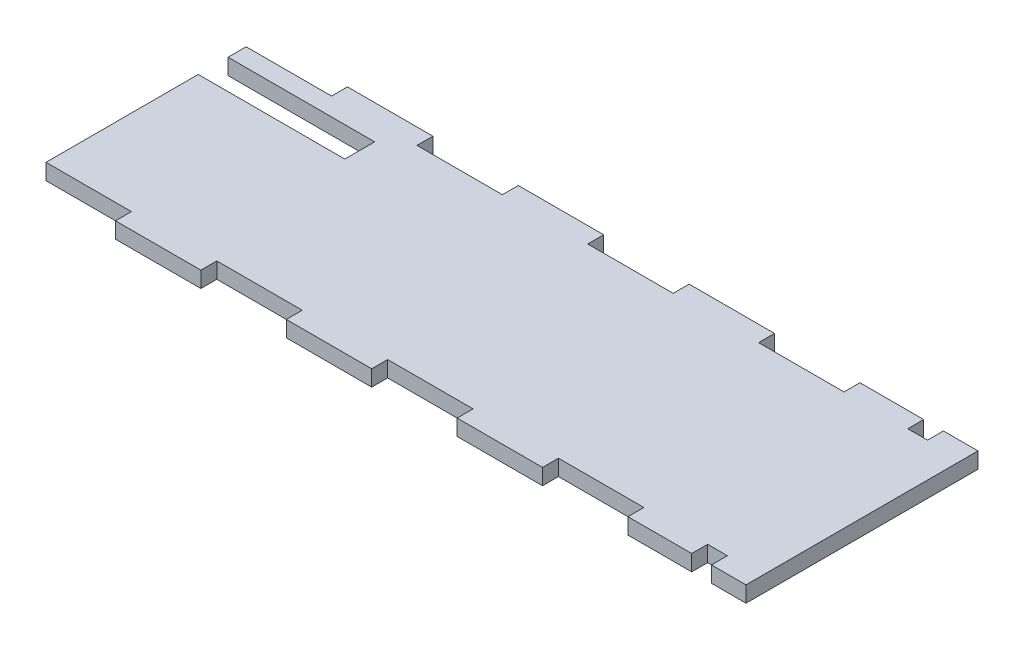
from build123d import *

# Parameters (mm, degrees)
BOSS_EXTRUDE1_DEPTH = 3.175
SKETCH2_W           = 29.21
SKETCH2_H           = 5.9436
CUT_EXTRUDE2_DEPTH  = 4.064


with BuildPart() as part:
    # Sketch1 → Boss-Extrude1 (new body)
    with BuildSketch(Plane(origin=(0, 0, 0), x_dir=(1, 0, 0), z_dir=(0, 1, 0))):
        Polygon((-54.3052, -23.114), (-37.2872, -23.114), (-37.2872, -19.939), (-20.2692, -19.939), (-20.2692, -23.114), (-3.2512, -23.114), (-3.2512, -19.939), (13.7668, -19.939), (13.7668, -23.114), (30.7848, -23.114), (30.7848, -19.939), (47.8028, -19.939), (47.8028, -23.114), (60.5028, -23.114), (60.5028, -19.939), (64.4398, -19.939), (64.4398, -23.114), (71.3232, -23.114), (71.3232, 23.114), (64.4398, 23.114), (64.4398, 19.939), (60.5028, 19.939), (60.5028, 23.114), (47.8028, 23.114), (47.8028, 19.939), (30.7848, 19.939), (30.7848, 23.114), (13.7668, 23.114), (13.7668, 19.939), (-3.2512, 19.939), (-3.2512, 23.114), (-20.2692, 23.114), (-20.2692, 19.939), (-37.2872, 19.939), (-37.2872, 23.114), (-54.3052, 23.114), (-54.3052, 19.939), (-71.3232, 19.939), (-71.3232, -19.939), (-54.3052, -19.939), align=None)
    extrude(amount=BOSS_EXTRUDE1_DEPTH)

    # Sketch2 → Cut-Extrude2 (cut)
    with BuildSketch(Plane(origin=(0, 3.175, 0), x_dir=(1, 0, 0), z_dir=(0, 1, 0))):
        with Locations((-56.7182, 13.3604)):
            Rectangle(SKETCH2_W, SKETCH2_H)
    extrude(amount=-CUT_EXTRUDE2_DEPTH, mode=Mode.SUBTRACT)


solid = part.part
